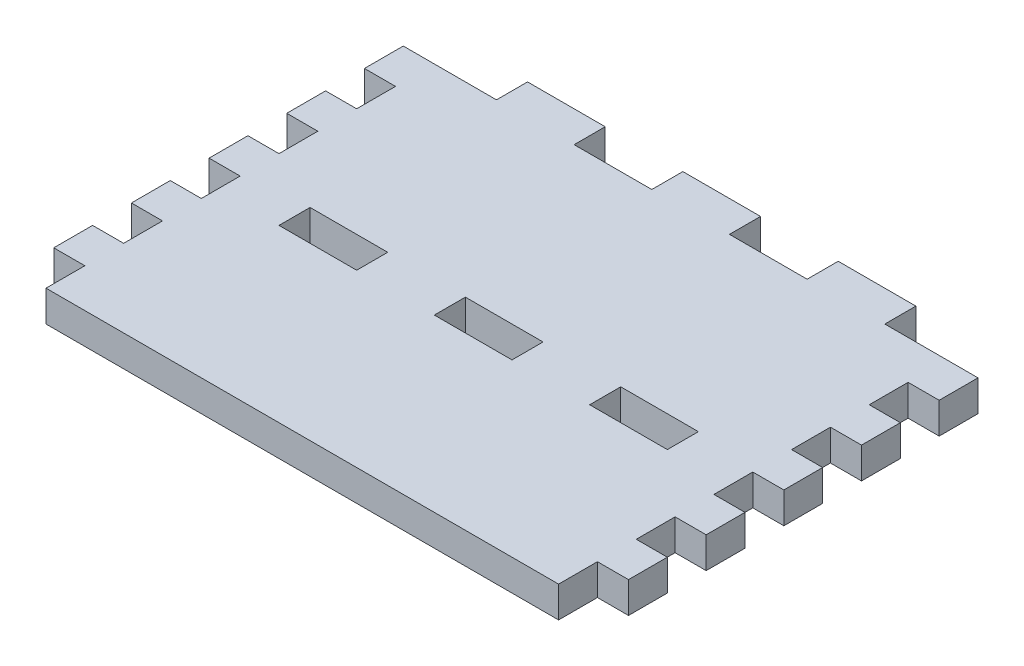
from build123d import *

# Parameters (mm, degrees)
SKETCH1_W           = 66
SKETCH1_H           = 50
BOSS_EXTRUDE1_DEPTH = 4
SKETCH2_W           = 4
SKETCH2_H           = 5
BOSS_EXTRUDE2_DEPTH = 4
LPATTERN1_COUNT     = 5
LPATTERN1_PITCH     = 10
SKETCH3_W           = 10
SKETCH3_H           = 4
BOSS_EXTRUDE3_DEPTH = 4
LPATTERN2_COUNT     = 2
LPATTERN2_PITCH     = 20
LPATTERN2_COL_COUNT = 2
LPATTERN2_COL_PITCH = 20
SKETCH4_W           = 10
SKETCH4_H           = 4
CUT_EXTRUDE1_DEPTH  = 87.116200566


with BuildPart() as part:
    # Sketch1 → Boss-Extrude1 (new body)
    with BuildSketch(Plane(origin=(0, 0, 0), x_dir=(1, 0, 0), z_dir=(0, 1, 0))):
        with Locations((33, -25)):
            Rectangle(SKETCH1_W, SKETCH1_H)
    extrude(amount=BOSS_EXTRUDE1_DEPTH)

    # Sketch2 → Boss-Extrude2 (add, through all)
    with BuildSketch(Plane(origin=(0, 4, 0), x_dir=(1, 0, 0), z_dir=(0, 1, 0))):
        with Locations((-2, -2.5)):
            Rectangle(SKETCH2_W, SKETCH2_H)
        with Locations((68, -2.5)):
            Rectangle(SKETCH2_W, SKETCH2_H)
    boss_extrude2 = extrude(amount=-BOSS_EXTRUDE2_DEPTH)

    # LPattern1: Boss-Extrude2 ×5
    with Locations(*[(0, 0, i * LPATTERN1_PITCH) for i in range(1, LPATTERN1_COUNT)]):
        add(boss_extrude2)

    # Sketch3 → Boss-Extrude3 (add, through all)
    with BuildSketch(Plane(origin=(0, 4, 0), x_dir=(1, 0, 0), z_dir=(0, 1, 0))):
        with Locations((33, 2)):
            Rectangle(SKETCH3_W, SKETCH3_H)
    boss_extrude3 = extrude(amount=-BOSS_EXTRUDE3_DEPTH)

    # LPattern2: Boss-Extrude3 ×2
    with Locations(*[(i * LPATTERN2_PITCH, 0, 0) for i in range(1, LPATTERN2_COUNT)]):
        add(boss_extrude3)

    # LPattern2 col: Boss-Extrude3 ×2
    with Locations(*[(-i * LPATTERN2_COL_PITCH, 0, 0) for i in range(1, LPATTERN2_COL_COUNT)]):
        add(boss_extrude3)

    # Sketch4 → Cut-Extrude1 (cut, through all)
    with BuildSketch(Plane.XZ):
        with Locations((13, 26)):
            Rectangle(SKETCH4_W, SKETCH4_H)
        with Locations((33, 26)):
            Rectangle(SKETCH4_W, SKETCH4_H)
        with Locations((53, 26)):
            Rectangle(SKETCH4_W, SKETCH4_H)
    extrude(amount=-CUT_EXTRUDE1_DEPTH, mode=Mode.SUBTRACT)


solid = part.part
